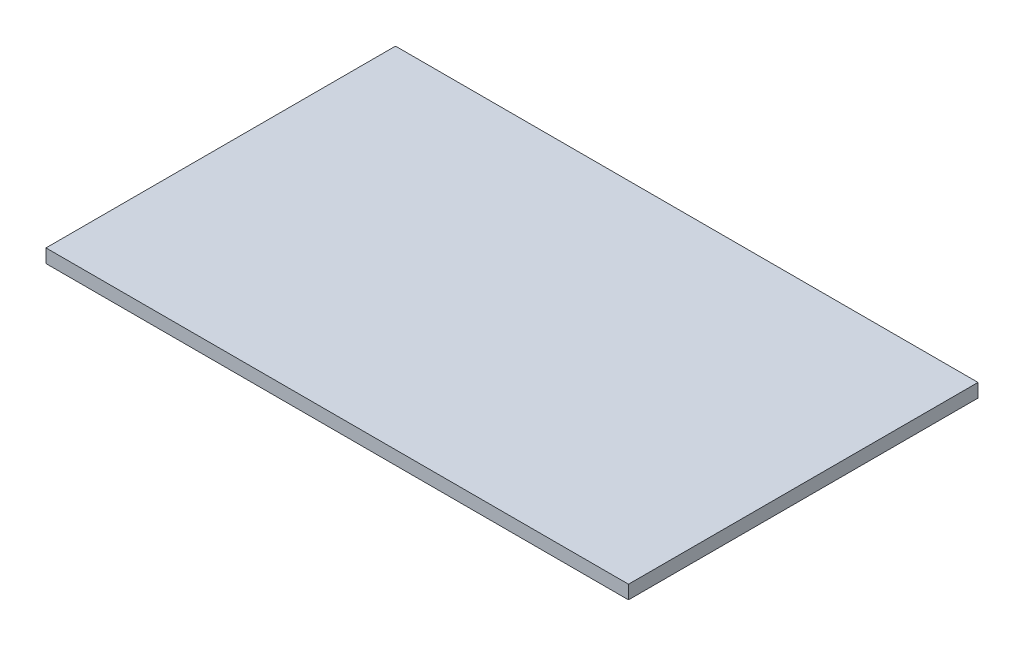
from build123d import *

# Parameters (mm, degrees)
SKETCH1_W           = 300
SKETCH1_H           = 180
BOSS_EXTRUDE1_DEPTH = 7


with BuildPart() as part:
    # Sketch1 → Boss-Extrude1 (new body)
    with BuildSketch(Plane(origin=(0, 0, 0), x_dir=(1, 0, 0), z_dir=(0, 1, 0))):
        with Locations((86.062103035, -47.993748753)):
            Rectangle(SKETCH1_W, SKETCH1_H)
    extrude(amount=BOSS_EXTRUDE1_DEPTH)


solid = part.part
